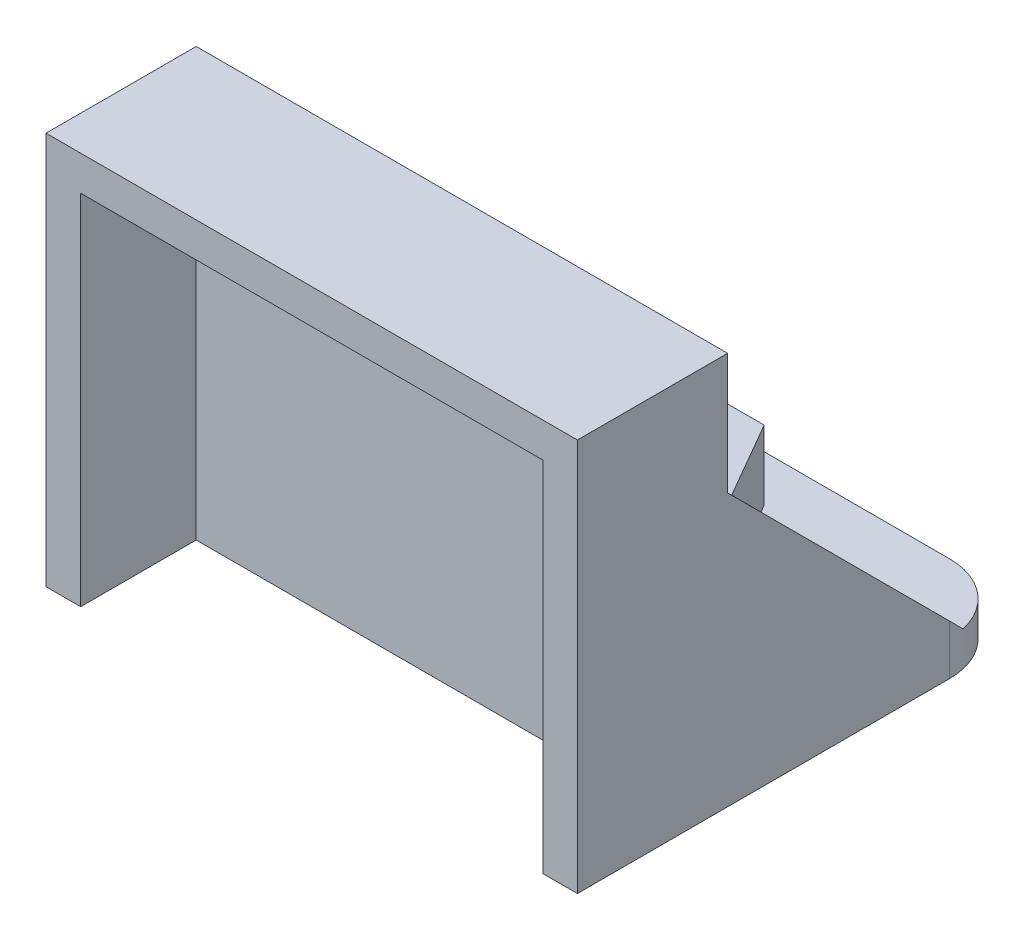
from build123d import *

# Parameters (mm, degrees)
SKETCH_1_W                  = 23
SKETCH_1_H                  = 17
EXTRUDE_1_DEPTH             = 6.5
SKETCH_2_W                  = 20
SKETCH_2_H                  = 15.5
CUT_EXTRUDE_1_DEPTH         = 5
SKETCH_3_W                  = 23
SKETCH_3_H                  = 1.5
EXTRUDE_2_DEPTH             = 12.6
EXTRUDE_3_DEPTH             = 3
EXTRUDE_6_REACH             = 21.397
SKETCH_7_W                  = 1.5
SKETCH_7_H                  = 7.259859141
EXTRUDE_6_DIRECTION_2_REACH = 21.397
HOLE_WIZARD_M3_1_D          = 3.2
FILLET_1_R                  = 3


with BuildPart() as part:
    # 草图1 → 凸台-拉伸1 (new body)
    with BuildSketch(Plane.XY):
        Rectangle(SKETCH_1_W, SKETCH_1_H)
    extrude(amount=EXTRUDE_1_DEPTH)

    # 草图2 → 切除-拉伸1 (cut)
    with BuildSketch(Plane.XY.offset(6.5)):
        with Locations((0, -0.75)):
            Rectangle(SKETCH_2_W, SKETCH_2_H)
    extrude(amount=-CUT_EXTRUDE_1_DEPTH, mode=Mode.SUBTRACT)

    # 草图3 → 凸台-拉伸2 (add)
    with BuildSketch(Plane(origin=(0, 0, 0), x_dir=(-1, 0, 0), z_dir=(0, 0, -1))):
        with Locations((0, -7.75)):
            Rectangle(SKETCH_3_W, SKETCH_3_H)
    extrude(amount=EXTRUDE_2_DEPTH)

    # 草图4 → 凸台-拉伸3 (add)
    with BuildSketch(Plane(origin=(0, -7, 0), x_dir=(1, 0, 0), z_dir=(0, 1, 0))):
        Polygon((4.965212315, 6.3), (2.482606158, 10.6), (-2.482606158, 10.6), (-4.965212315, 6.3), (-2.482606158, 2), (2.482606158, 2), align=None)
        Polygon((3.233161507, 6.3), (1.616580754, 9.1), (-1.616580754, 9.1), (-3.233161507, 6.3), (-1.616580754, 3.5), (1.616580754, 3.5), align=None, mode=Mode.SUBTRACT)
    extrude(amount=EXTRUDE_3_DEPTH)

    # 凸台-拉伸6: up to this face of the body (flat: up to its plane)
    extrude_6_end = Plane(part.part.faces().sort_by_distance((0, -7, -6.3))[0])
    # 草图7 → 凸台-拉伸6 (add, up to the picked face)
    with BuildSketch(Plane(origin=(0, -3.5, -3.5), x_dir=(-1, 0, 0), z_dir=(0, -0.7071067811865475, -0.7071067811865477)), mode=Mode.PRIVATE) as extrude_6_sk1:
        with Locations((-10.75, -1.319817897)):
            Rectangle(SKETCH_7_W, SKETCH_7_H)
    extrude_6_tool1 = split(extrude(extrude_6_sk1.sketch, amount=EXTRUDE_6_REACH, mode=Mode.PRIVATE), bisect_by=extrude_6_end, keep=Keep.BOTH, mode=Mode.PRIVATE)
    extrude_6 = extrude_6_tool1.solids().sort_by(Axis((10.75, -4.433252, -2.566748), (0, -0.7071067811865475, -0.7071067811865477)))[0]
    add(extrude_6)

    # 凸台-拉伸6 direction 2: up to this face of the body (flat: up to its plane)
    extrude_6_direction_2_end = Plane(part.part.faces().sort_by_distance((0, 0.75, 0))[0])
    # 草图7 → 凸台-拉伸6 direction 2 (add, up to the picked face)
    with BuildSketch(Plane(origin=(0, -3.5, -3.5), x_dir=(-1, 0, 0), z_dir=(0, -0.7071067811865475, -0.7071067811865477)), mode=Mode.PRIVATE) as extrude_6_direction_2_sk1:
        with Locations((-10.75, -1.319817897)):
            Rectangle(SKETCH_7_W, SKETCH_7_H)
    extrude_6_direction_2_tool1 = split(extrude(extrude_6_direction_2_sk1.sketch, amount=-EXTRUDE_6_DIRECTION_2_REACH, mode=Mode.PRIVATE), bisect_by=extrude_6_direction_2_end, keep=Keep.BOTH, mode=Mode.PRIVATE)
    extrude_6_direction_2 = extrude_6_direction_2_tool1.solids().sort_by(Axis((10.75, -4.433252, -2.566748), (0, 0.7071067811865475, 0.7071067811865477)))[0]
    add(extrude_6_direction_2)

    # 镜向1: 凸台-拉伸6, 凸台-拉伸6 direction 2 across plane
    add(extrude_6.mirror(Plane(origin=(0, 0, 0), x_dir=(0, 0, 1), z_dir=(1, 0, 0))))
    add(extrude_6_direction_2.mirror(Plane(origin=(0, 0, 0), x_dir=(0, 0, 1), z_dir=(1, 0, 0))))

    # M3 间隙孔1 (through all)
    with Locations(Plane(origin=(0, -7, 0), x_dir=(1, 0, 0), z_dir=(0, 1, 0))):
        with Locations((0, 6.3)):
            Hole(HOLE_WIZARD_M3_1_D / 2)

    # 圆角1
    fillet_1_edges = [part.edges().sort_by_distance(p)[0] for p in [
        (-11.5, -7.75, -12.6),
        (11.5, -7.75, -12.6),
    ]]
    fillet(fillet_1_edges, radius=FILLET_1_R)


solid = part.part
